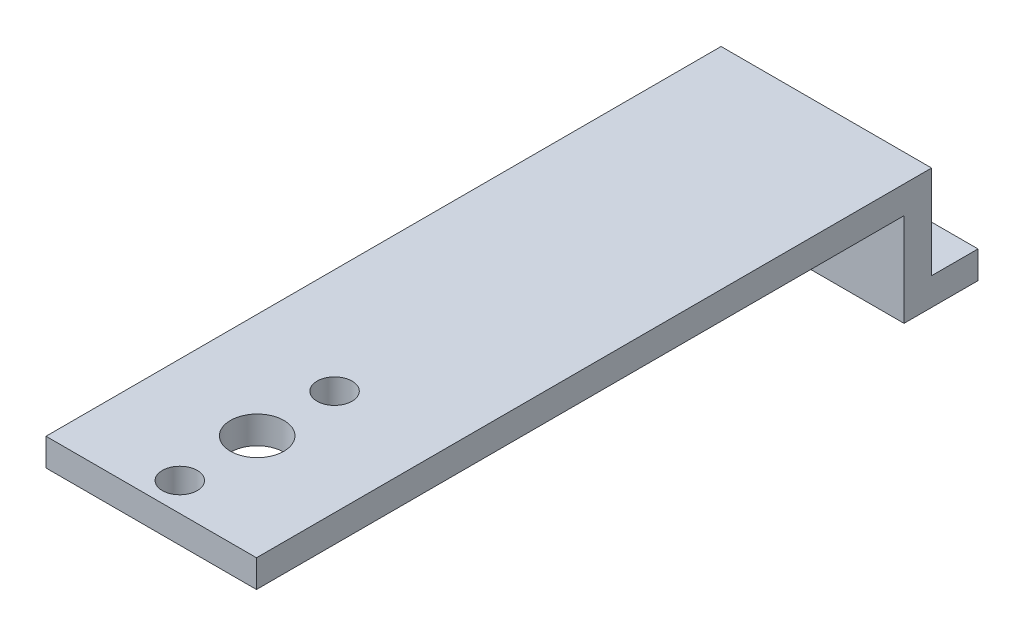
from build123d import *

# Parameters (mm, degrees)
BOSS_EXTRUDE1_DEPTH      = 6.8
BOSS_EXTRUDE1_DEPTH_BACK = 6.8
CUT_EXTRUDE1_REACH       = 45.967
SKETCH2_R                = 1.1303
SKETCH2_R_2              = 1.7272


with BuildPart() as part:
    # Sketch1 → Boss-Extrude1 (new, two sides: drawn at the far end of the back side and taken through both)
    with BuildSketch(Plane(origin=(0, 0, 0), x_dir=(0, 0, -1), z_dir=(1, 0, 0)).offset(-BOSS_EXTRUDE1_DEPTH_BACK)):
        Polygon((0.889, 3.903), (-0.889, 3.903), (-42.731, 3.903), (-42.731, 2.125), (-0.889, 2.125), (-0.889, -3.903), (3.889, -3.903), (3.889, -2.125), (0.889, -2.125), align=None)
    extrude(amount=BOSS_EXTRUDE1_DEPTH + BOSS_EXTRUDE1_DEPTH_BACK)

    # Sketch2 → Cut-Extrude1 (cut, up to next)
    with BuildSketch(Plane(origin=(0, 3.903, 0), x_dir=(1, 0, 0), z_dir=(0, 1, 0)), mode=Mode.PRIVATE) as cut_extrude1_sk1:
        with Locations((0, -40.8857)):
            Circle(SKETCH2_R)
    cut_extrude1_tool1 = extrude(cut_extrude1_sk1.sketch, amount=-CUT_EXTRUDE1_REACH, mode=Mode.PRIVATE) & part.part
    # Sketch2 → Cut-Extrude1 (cut, up to next)
    with BuildSketch(Plane(origin=(0, 3.903, 0), x_dir=(1, 0, 0), z_dir=(0, 1, 0)), mode=Mode.PRIVATE) as cut_extrude1_sk2:
        with Locations((0, -35.8857)):
            Circle(SKETCH2_R_2)
    cut_extrude1_tool2 = extrude(cut_extrude1_sk2.sketch, amount=-CUT_EXTRUDE1_REACH, mode=Mode.PRIVATE) & part.part
    # Sketch2 → Cut-Extrude1 (cut, up to next)
    with BuildSketch(Plane(origin=(0, 3.903, 0), x_dir=(1, 0, 0), z_dir=(0, 1, 0)), mode=Mode.PRIVATE) as cut_extrude1_sk3:
        with Locations((0, -30.8857)):
            Circle(SKETCH2_R)
    cut_extrude1_tool3 = extrude(cut_extrude1_sk3.sketch, amount=-CUT_EXTRUDE1_REACH, mode=Mode.PRIVATE) & part.part
    add(cut_extrude1_tool1.solids().sort_by_distance((0, 3.903, 40.8857))[0], mode=Mode.SUBTRACT)
    add(cut_extrude1_tool2.solids().sort_by_distance((0, 3.903, 35.8857))[0], mode=Mode.SUBTRACT)
    add(cut_extrude1_tool3.solids().sort_by_distance((0, 3.903, 30.8857))[0], mode=Mode.SUBTRACT)


solid = part.part
